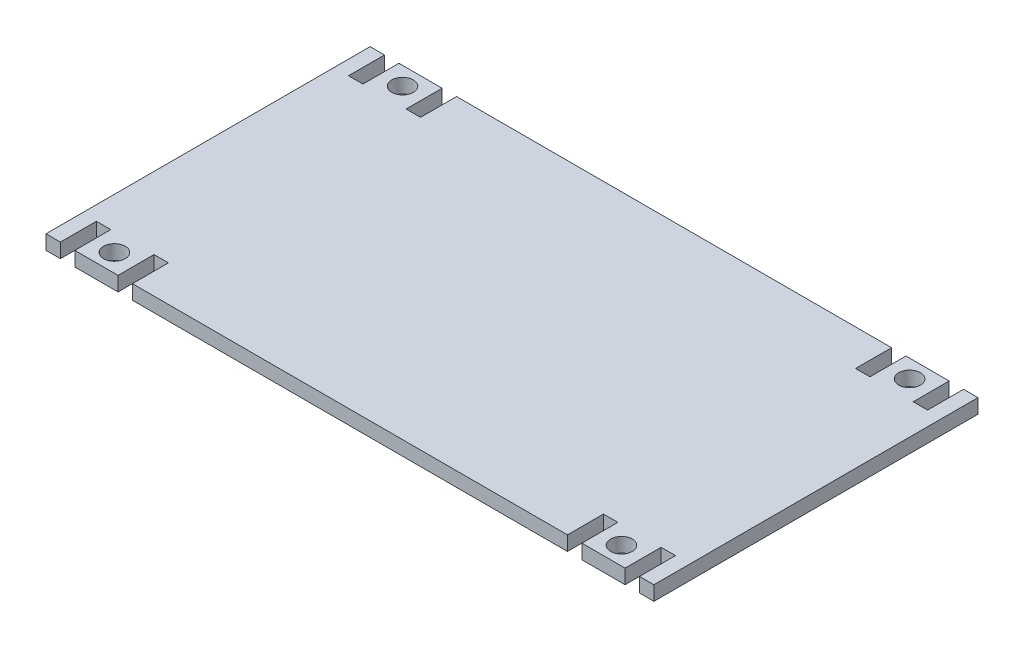
from build123d import *

# Parameters (mm, degrees)
SKETCH1_R           = 1.5
BOSS_EXTRUDE1_DEPTH = 2


with BuildPart() as part:
    # Sketch1 → Boss-Extrude1 (new body)
    with BuildSketch(Plane(origin=(0, 0, 0), x_dir=(1, 0, 0), z_dir=(0, 1, 0))):
        Polygon((0, 0), (2, 0), (2, 5), (4, 5), (4, 0), (10, 0), (10, 5), (12, 5), (12, 0), (72.4, 0), (72.4, 5), (74.4, 5), (74.4, 0), (80.4, 0), (80.4, 5), (82.4, 5), (82.4, 0), (84.4, 0), (84.4, 45), (82.4, 45), (82.4, 40), (80.4, 40), (80.4, 45), (74.4, 45), (74.4, 40), (72.4, 40), (72.4, 45), (12, 45), (12, 40), (10, 40), (10, 45), (4, 45), (4, 40), (2, 40), (2, 45), (0, 45), align=None)
        with Locations(Location((7, 42.5, 0), (0, 0, 270))):
            Circle(SKETCH1_R, mode=Mode.SUBTRACT)
        with Locations(Location((77.4, 42.5, 0), (0, 0, 90))):
            Circle(SKETCH1_R, mode=Mode.SUBTRACT)
        with Locations(Location((7, 2.5, 0), (0, 0, 90))):
            Circle(SKETCH1_R, mode=Mode.SUBTRACT)
        with Locations(Location((77.4, 2.5, 0), (0, 0, 270))):
            Circle(SKETCH1_R, mode=Mode.SUBTRACT)
    extrude(amount=BOSS_EXTRUDE1_DEPTH)


solid = part.part
